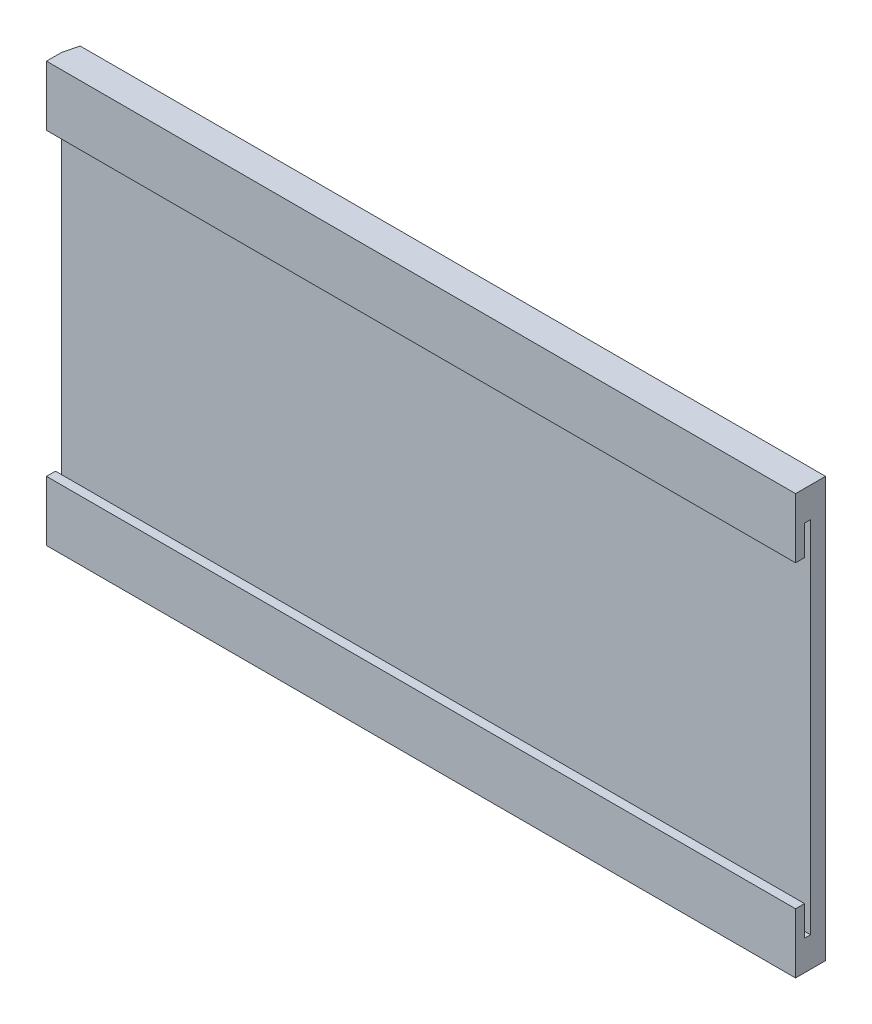
from build123d import *

# Parameters (mm, degrees)
BOSS_EXTRUDE1_DEPTH      = 5
BOSS_EXTRUDE1_DEPTH_BACK = 5
SKETCH1_W                = 250
SKETCH1_H                = 140
SKETCH1_3_W              = 250
SKETCH1_3_H              = 100
CUT_EXTRUDE1_DEPTH       = 260.663243452
SKETCH1_4_W              = 250
SKETCH1_4_H              = 10
CUT_EXTRUDE2_DEPTH       = 2
CUT_EXTRUDE3_DEPTH       = 260.663243452
CUT_EXTRUDE3_DEPTH_BACK  = 260.663243452


with BuildPart() as part:
    # Sketch1 → Boss-Extrude1 (new, two sides: drawn at the far end of the back side and taken through both)
    with BuildSketch(Plane.XY.offset(-BOSS_EXTRUDE1_DEPTH_BACK)):
        with Locations((125, 0)):
            Rectangle(SKETCH1_W, SKETCH1_H)
    extrude(amount=BOSS_EXTRUDE1_DEPTH + BOSS_EXTRUDE1_DEPTH_BACK)

    # Sketch1<3> → Cut-Extrude1 (cut, through all)
    with BuildSketch(Plane.XY):
        with Locations((125, 0)):
            Rectangle(SKETCH1_3_W, SKETCH1_3_H)
    extrude(amount=CUT_EXTRUDE1_DEPTH, mode=Mode.SUBTRACT)

    # Sketch1<4> → Cut-Extrude2 (cut)
    with BuildSketch(Plane.XY):
        with Locations((125, 55)):
            Rectangle(SKETCH1_4_W, SKETCH1_4_H)
        with Locations((125, -55)):
            Rectangle(SKETCH1_4_W, SKETCH1_4_H)
    extrude(amount=CUT_EXTRUDE2_DEPTH, mode=Mode.SUBTRACT)

    # Sketch2 → Cut-Extrude3 (cut, two sides: drawn at the far end of the back side and taken through both)
    with BuildSketch(Plane(origin=(0, 0, 0), x_dir=(1, 0, 0), z_dir=(0, 1, 0)).offset(-CUT_EXTRUDE3_DEPTH_BACK)):
        Polygon((0, 0), (7.5, 30), (0, 30), align=None)
    extrude(amount=CUT_EXTRUDE3_DEPTH + CUT_EXTRUDE3_DEPTH_BACK, mode=Mode.SUBTRACT)


solid = part.part
